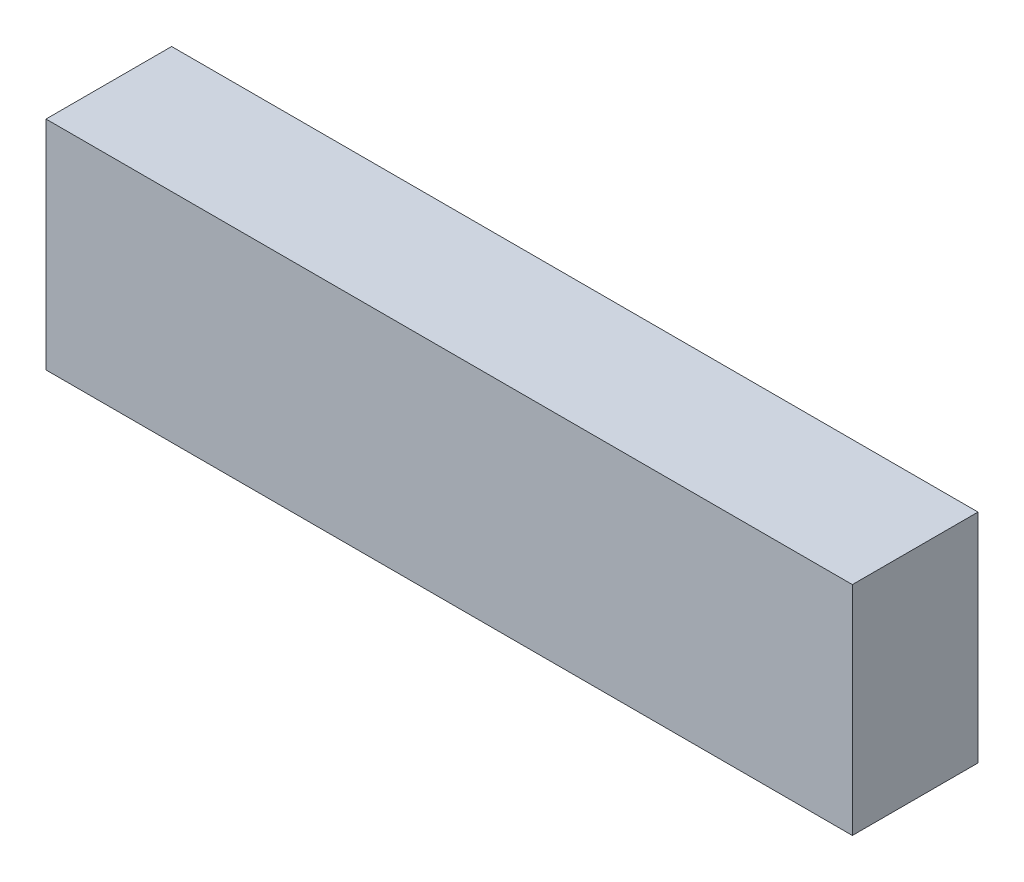
from build123d import *

# Parameters (mm, degrees)
SKETCH1_W                 = 46.53230149
SKETCH1_H                 = 12.54
BOSS_EXTRUDE1_DEPTH       = 7.25
SHELL1_T                  = -0.5
SHELL1_THICKNESS_2_FACE_W = 45.53230149
SHELL1_THICKNESS_2_FACE_H = 11.54
SHELL1_THICKNESS_2_DEPTH  = 0.3


with BuildPart() as part:
    # Sketch1 → Boss-Extrude1 (new body)
    with BuildSketch(Plane.XY):
        with Locations((55.770650745, -39.84)):
            Rectangle(SKETCH1_W, SKETCH1_H)
    extrude(amount=BOSS_EXTRUDE1_DEPTH)

    # Shell1
    shell1_openings = [part.faces().sort_by_distance(p)[0] for p in [
        (55.770650745, -39.84, 0),
    ]]
    offset(amount=SHELL1_T, openings=shell1_openings, kind=Kind.INTERSECTION)

    # Shell1 thickness 2 face (on inner face of the shell) → Shell1 thickness 2 (cut)
    with BuildSketch(Plane(origin=(55.770650745, -39.84, 6.75), x_dir=(1, 0, 0), z_dir=(0, 0, 1))):
        Rectangle(SHELL1_THICKNESS_2_FACE_W, SHELL1_THICKNESS_2_FACE_H)
    extrude(amount=SHELL1_THICKNESS_2_DEPTH, mode=Mode.SUBTRACT)


solid = part.part
